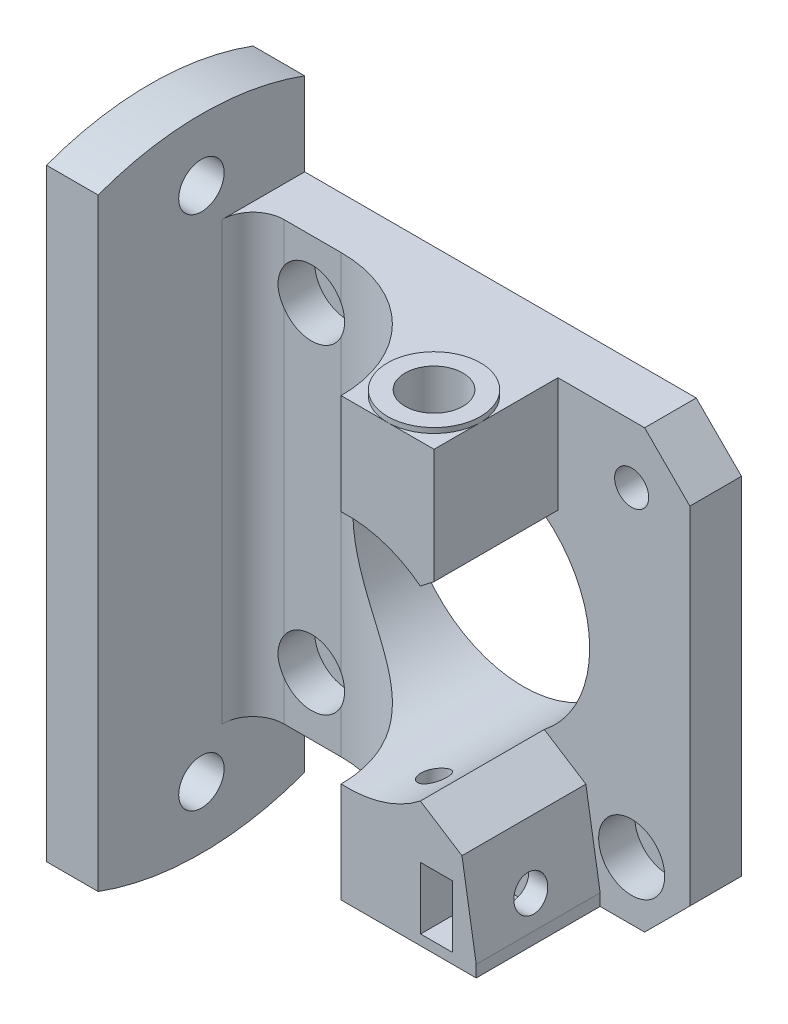
from build123d import *

# Parameters (mm, degrees)
SKETCH1_W               = 42.3
SKETCH1_H               = 42.3
BOSS_EXTRUDE1_DEPTH     = 5
CHAMFER1_SIZE           = 4.38
SKETCH4_W               = 5
SKETCH4_H               = 62
BOSS_EXTRUDE2_DEPTH     = 20
SKETCH5_R               = 2.2
CUT_EXTRUDE3_DEPTH      = 60.985748307
BOSS_EXTRUDE3_DEPTH     = 42.3
FILLET1_R               = 3
CUT_EXTRUDE1_DEPTH      = 44.24144424
CUT_EXTRUDE1_DEPTH_BACK = 44.24144424
SKETCH2_R               = 11.433895
SKETCH2_R_2             = 1.65
CUT_EXTRUDE2_DEPTH      = 44.24144424
CUT_EXTRUDE2_DEPTH_BACK = 3.5
SKETCH3_R               = 3.2
SKETCH7_R               = 1.27442
CUT_EXTRUDE4_DEPTH      = 62.672076339
BOSS_EXTRUDE4_START     = 0.5
SKETCH8_R               = 3.5
SKETCH8_R_2             = 1.27442
BOSS_EXTRUDE4_DEPTH     = 0.5
SKETCH9_R               = 2.8
CUT_EXTRUDE5_DEPTH      = 4
BOSS_EXTRUDE5_START     = 0.5
SKETCH10_R              = 4.5
SKETCH10_R_2            = 2.8
BOSS_EXTRUDE5_DEPTH     = 0.5
SKETCH11_W              = 3.1
SKETCH11_H              = 6
CUT_EXTRUDE6_DEPTH      = 7.826
CUT_EXTRUDE7_DEPTH      = 50.648434779
CUT_EXTRUDE7_DEPTH_BACK = 0.45
SKETCH12_R              = 1.62
CUT_EXTRUDE8_REACH      = 45.975


with BuildPart() as part:
    # Sketch1 → Boss-Extrude1 (new body)
    with BuildSketch(Plane.XY):
        Rectangle(SKETCH1_W, SKETCH1_H)
    extrude(amount=BOSS_EXTRUDE1_DEPTH)

    # Chamfer1
    chamfer1_edges = [part.edges().sort_by_distance(p)[0] for p in [
        (21.15, -21.15, 2.5),
        (21.15, 21.15, 2.5),
    ]]
    chamfer(chamfer1_edges, length=CHAMFER1_SIZE)

    # Sketch4 → Boss-Extrude2 (add)
    with BuildSketch(Plane(origin=(0, 0, 0), x_dir=(-1, 0, 0), z_dir=(0, 0, -1))):
        with Locations((23.65, 0)):
            Rectangle(SKETCH4_W, SKETCH4_H)
    extrude(amount=-BOSS_EXTRUDE2_DEPTH)

    # Sketch5 → Cut-Extrude3 (cut, through all)
    with BuildSketch(Plane.ZY.offset(26.15)):
        with Locations((10, 25)):
            Circle(SKETCH5_R)
        with Locations((10, -25)):
            Circle(SKETCH5_R)
        with BuildLine():
            Line((0, 29.205999997), (0, 32.205999997))
            Line((0, 32.205999997), (20, 32.205999997))
            Line((20, 32.205999997), (20, 29.205999997))
            ThreePointArc((20, 29.205999997), (10, 31), (0, 29.205999997))
        make_face()
        with BuildLine():
            Line((20, -29.205999997), (20, -32.205999997))
            Line((20, -32.205999997), (0, -32.205999997))
            Line((0, -32.205999997), (0, -29.205999997))
            ThreePointArc((0, -29.205999997), (10, -31), (20, -29.205999997))
        make_face()
    extrude(amount=-CUT_EXTRUDE3_DEPTH, mode=Mode.SUBTRACT)

    # Sketch6 → Boss-Extrude3 (add)
    with BuildSketch(Plane.XZ.offset(21.15)):
        with BuildLine():
            Line((12.462, 5), (12.462, 17))
            Line((12.462, 17), (-0.624, 17))
            ThreePointArc((-0.624, 17), (-4.138718626, 8.514718626), (-12.624, 5))
            Line((-12.624, 5), (12.462, 5))
        make_face()
    extrude(amount=-BOSS_EXTRUDE3_DEPTH)

    # Fillet1
    fillet1_edges = [part.edges().sort_by_distance(p)[0] for p in [
        (-21.15, 0, 5),
    ]]
    fillet(fillet1_edges, radius=FILLET1_R)

    # Sketch2 → Cut-Extrude1 (cut, two sides: drawn at the far end of the back side and taken through both)
    with BuildSketch(Plane.XY.offset(5).offset(-CUT_EXTRUDE1_DEPTH_BACK)):
        with Locations(Location((0.01611, 0, 0), (0, 0, 266.790701126))):
            Circle(SKETCH2_R)
        with Locations(Location((-15.48389, 15.5, 0), (0, 0, 180))):
            Circle(SKETCH2_R_2)
        with Locations(Location((15.51611, 15.5, 0), (0, 0, 180))):
            Circle(SKETCH2_R_2)
        with Locations(Location((15.51611, -15.5, 0), (0, 0, 180))):
            Circle(SKETCH2_R_2)
        with Locations(Location((-15.48389, -15.5, 0), (0, 0, 180))):
            Circle(SKETCH2_R_2)
    extrude(amount=CUT_EXTRUDE1_DEPTH + CUT_EXTRUDE1_DEPTH_BACK, mode=Mode.SUBTRACT)

    # Sketch3 → Cut-Extrude2 (cut, two sides: drawn at the far end of the back side and taken through both)
    with BuildSketch(Plane.XY.offset(5).offset(-CUT_EXTRUDE2_DEPTH_BACK)):
        with Locations(Location((-15.48389, 15.5, 0), (0, 0, 213.57533661))):
            Circle(SKETCH3_R)
        with Locations(Location((-15.48389, -15.5, 0), (0, 0, 213.57533661))):
            Circle(SKETCH3_R)
        with Locations(Location((15.51611, -15.5, 0), (0, 0, 197.367581673))):
            Circle(SKETCH3_R)
    extrude(amount=CUT_EXTRUDE2_DEPTH + CUT_EXTRUDE2_DEPTH_BACK, mode=Mode.SUBTRACT)

    # Sketch7 → Cut-Extrude4 (cut, through all)
    with BuildSketch(Plane.XZ.offset(21.15)):
        with Locations(Location((3.87669, 12.5, 0), (0, 0, 270))):
            Circle(SKETCH7_R)
    extrude(amount=-CUT_EXTRUDE4_DEPTH, mode=Mode.SUBTRACT)

    # Sketch8 → Boss-Extrude4 (add)
    with BuildSketch(Plane.XZ.offset(21.15).offset(BOSS_EXTRUDE4_START)):
        with Locations(Location((3.87669, 12.5, 0), (0, 0, 90))):
            Circle(SKETCH8_R)
        with Locations(Location((3.87669, 12.5, 0), (0, 0, 270))):
            Circle(SKETCH8_R_2, mode=Mode.SUBTRACT)
    extrude(amount=-BOSS_EXTRUDE4_DEPTH)

    # Sketch9 → Cut-Extrude5 (cut)
    with BuildSketch(Plane(origin=(0, 21.15, 0), x_dir=(1, 0, 0), z_dir=(0, 1, 0))):
        with Locations(Location((3.87669, -12.5, 0), (0, 0, 270))):
            Circle(SKETCH9_R)
    extrude(amount=-CUT_EXTRUDE5_DEPTH, mode=Mode.SUBTRACT)

    # Sketch10 → Boss-Extrude5 (add)
    with BuildSketch(Plane(origin=(0, 21.15, 0), x_dir=(1, 0, 0), z_dir=(0, 1, 0)).offset(BOSS_EXTRUDE5_START)):
        with Locations(Location((3.87669, -12.5, 0), (0, 0, 270))):
            Circle(SKETCH10_R)
        with Locations(Location((3.87669, -12.5, 0), (0, 0, 270))):
            Circle(SKETCH10_R_2, mode=Mode.SUBTRACT)
    extrude(amount=-BOSS_EXTRUDE5_DEPTH)

    # Sketch11 → Cut-Extrude6 (cut)
    with BuildSketch(Plane.XY.offset(17)):
        with Locations((8.626, -17.15)):
            Rectangle(SKETCH11_W, SKETCH11_H)
    extrude(amount=-CUT_EXTRUDE6_DEPTH, mode=Mode.SUBTRACT)

    # Sketch12 → Cut-Extrude7 (cut, two sides: drawn at the far end of the back side and taken through both)
    with BuildSketch(Plane(origin=(7.076, 0, 0), x_dir=(0, 0, -1), z_dir=(1, 0, 0)).offset(-CUT_EXTRUDE7_DEPTH_BACK)):
        with Locations(Location((-11.25, -17.15, 0), (0, 0, 154.603036972))):
            Circle(SKETCH12_R)
    extrude(amount=CUT_EXTRUDE7_DEPTH + CUT_EXTRUDE7_DEPTH_BACK, mode=Mode.SUBTRACT)

    # Cut-Extrude8: up to this face of the body (flat: up to its plane)
    cut_extrude8_end = Plane(part.part.faces().sort_by_distance((16.794233337, 1.179955887, 5))[0])
    # Sketch13 → Cut-Extrude8 (cut, up to the picked face)
    with BuildSketch(Plane.XY.offset(17), mode=Mode.PRIVATE) as cut_extrude8_sk1:
        with BuildLine():
            Line((12.462, 21.15), (8.37669, 21.15))
            Line((8.37669, 21.15), (8.37669, 10.042))
            Line((8.37669, 10.042), (7.05269, 9.012241496))
            ThreePointArc((7.05269, 9.012241496), (11.450004992, -0.000437691), (7.052, -9.012780191))
            Line((7.052, -9.012780191), (11.082, -11.582))
            Line((11.082, -11.582), (12.462, -20))
            Line((12.462, -20), (12.462, 21.15))
        make_face()
    cut_extrude8_tool1 = split(extrude(cut_extrude8_sk1.sketch, amount=-CUT_EXTRUDE8_REACH, mode=Mode.PRIVATE), bisect_by=cut_extrude8_end, keep=Keep.BOTH, mode=Mode.PRIVATE)
    add(cut_extrude8_tool1.solids().sort_by(Axis((10.711689, 5.447253, 17), (0, 0, -1)))[0], mode=Mode.SUBTRACT)


solid = part.part
